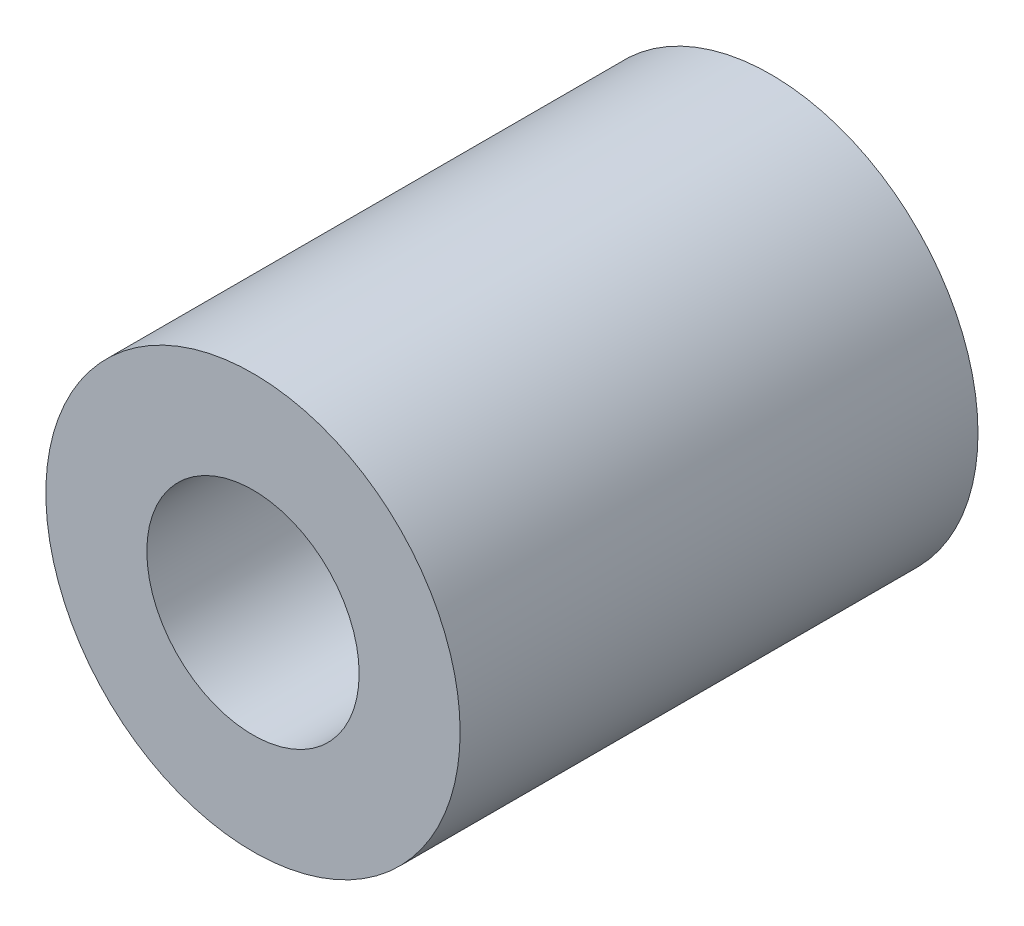
from build123d import *

# Parameters (mm, degrees)
SZKIC1_R                    = 4
DODANIE_WYCI_GNI_CIE1_DEPTH = 10
SZKIC2_R                    = 2.05
WYTNIJ_WYCI_GNI_CIE1_DEPTH  = 10


with BuildPart() as part:
    # Szkic1 → Dodanie-wyciągnięcie1 (new body)
    with BuildSketch(Plane.XY):
        with Locations((170.3, 97.184311715)):
            Circle(SZKIC1_R)
    extrude(amount=DODANIE_WYCI_GNI_CIE1_DEPTH)

    # Szkic2 → Wytnij-wyciągnięcie1 (cut)
    with BuildSketch(Plane.XY.offset(10)):
        with Locations((170.3, 97.184311715)):
            Circle(SZKIC2_R)
    extrude(amount=-WYTNIJ_WYCI_GNI_CIE1_DEPTH, mode=Mode.SUBTRACT)


solid = part.part
